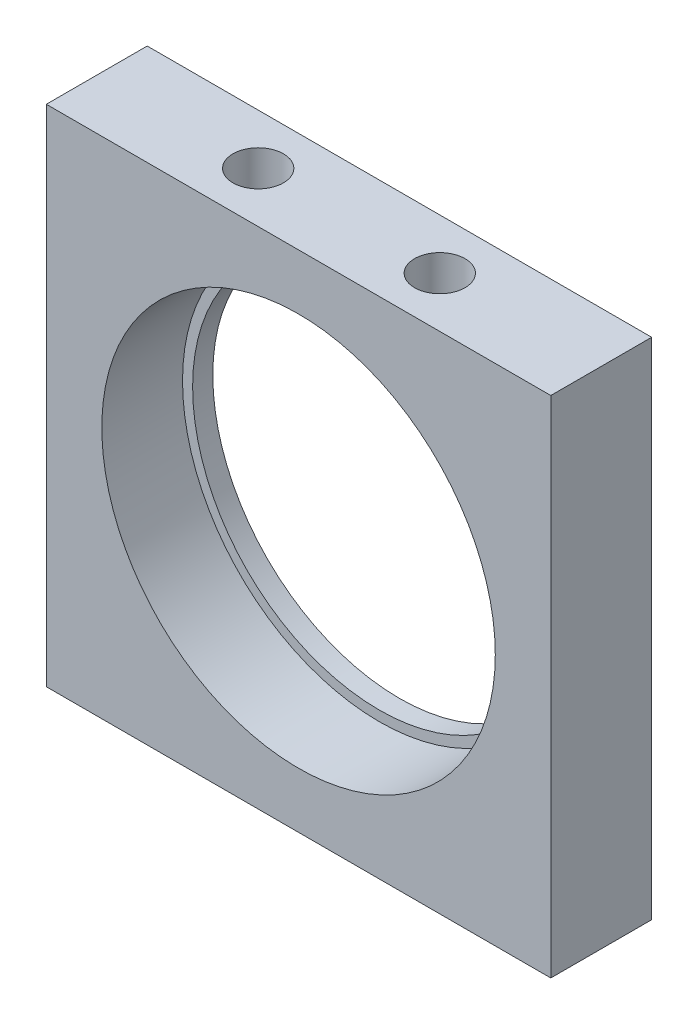
from build123d import *

# Parameters (mm, degrees)
SKETCH1_W                 = 25
SKETCH1_H                 = 25
SKETCH1_R                 = 9.25
BOSS_EXTRUDE1_DEPTH       = 5
M3X0_5_TAPPED_HOLE1_D     = 2.5
M3X0_5_TAPPED_HOLE1_DEPTH = 7.5
M3X0_5_TAPPED_HOLE1_TIP   = 0.751075774
SKETCH4_R                 = 9.75
CUT_EXTRUDE1_DEPTH        = 4


with BuildPart() as part:
    # Sketch1 → Boss-Extrude1 (new body)
    with BuildSketch(Plane.XY):
        Rectangle(SKETCH1_W, SKETCH1_H)
        Circle(SKETCH1_R, mode=Mode.SUBTRACT)
    extrude(amount=BOSS_EXTRUDE1_DEPTH)

    # M3x0.5 Tapped Hole1
    with Locations(Plane(origin=(0, 12.5, 0), x_dir=(-1, 0, 0), z_dir=(0, 1, 0))):
        with Locations((4.5, 2.5), (-4.5, 2.5)):
            Hole(M3X0_5_TAPPED_HOLE1_D / 2, depth=M3X0_5_TAPPED_HOLE1_DEPTH)
            with Locations((0, 0, -(M3X0_5_TAPPED_HOLE1_DEPTH + M3X0_5_TAPPED_HOLE1_TIP / 2))):  # 118° drill point
                Cone(0, M3X0_5_TAPPED_HOLE1_D / 2, M3X0_5_TAPPED_HOLE1_TIP, mode=Mode.SUBTRACT)

    # Sketch4 → Cut-Extrude1 (cut)
    with BuildSketch(Plane.XY.offset(5)):
        Circle(SKETCH4_R)
    extrude(amount=-CUT_EXTRUDE1_DEPTH, mode=Mode.SUBTRACT)


solid = part.part
